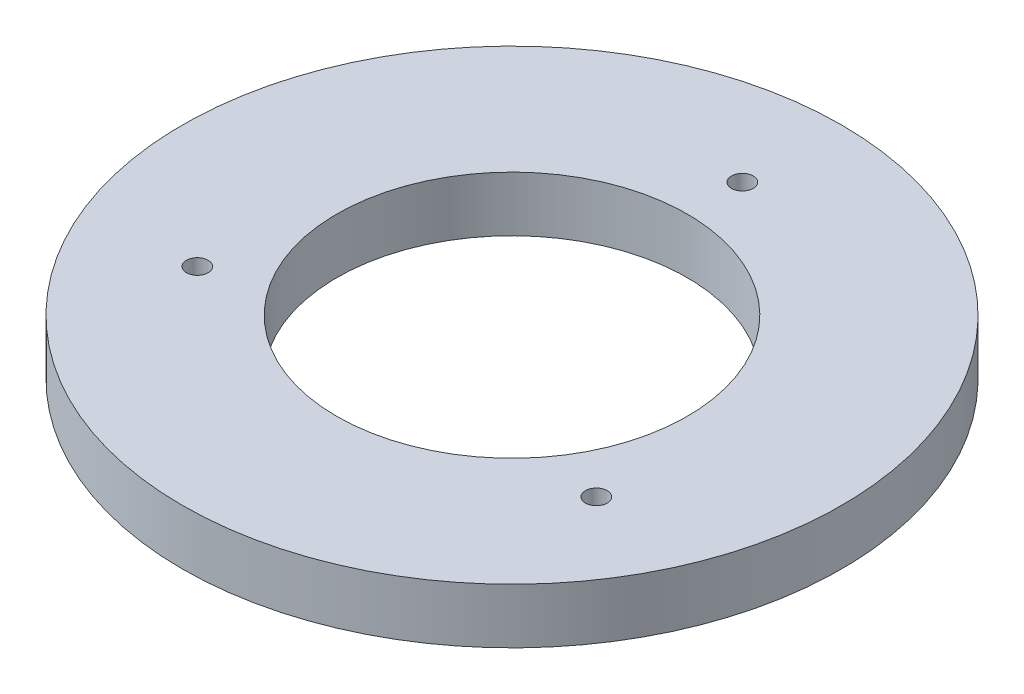
from build123d import *

# Parameters (mm, degrees)
SKETCH2_R           = 37.973
SKETCH2_R_2         = 20.193
BOSS_EXTRUDE1_DEPTH = 3.175
SKETCH4_R           = 1.25
CUT_EXTRUDE1_DEPTH  = 55.07605716


with BuildPart() as part:
    # Sketch2 → Boss-Extrude1 (new, symmetric)
    with BuildSketch(Plane(origin=(0, 0, 0), x_dir=(1, 0, 0), z_dir=(0, 1, 0))):
        with Locations(Location((0, 0, 0), (0, 0, 270))):
            Circle(SKETCH2_R)
        with Locations(Location((0, 0, 0), (0, 0, 270))):
            Circle(SKETCH2_R_2, mode=Mode.SUBTRACT)
    extrude(amount=BOSS_EXTRUDE1_DEPTH, both=True)

    # Sketch4 → Cut-Extrude1 (cut, through all)
    with BuildSketch(Plane(origin=(0, 3.175, 0), x_dir=(1, 0, 0), z_dir=(0, 1, 0))):
        with Locations(Location((-22.987, -13.271550638, 0), (0, 0, 270))):
            Circle(SKETCH4_R)
        with Locations(Location((0, 26.543101276, 0), (0, 0, 270))):
            Circle(SKETCH4_R)
        with Locations(Location((22.987, -13.271550638, 0), (0, 0, 270))):
            Circle(SKETCH4_R)
    extrude(amount=-CUT_EXTRUDE1_DEPTH, mode=Mode.SUBTRACT)


solid = part.part
